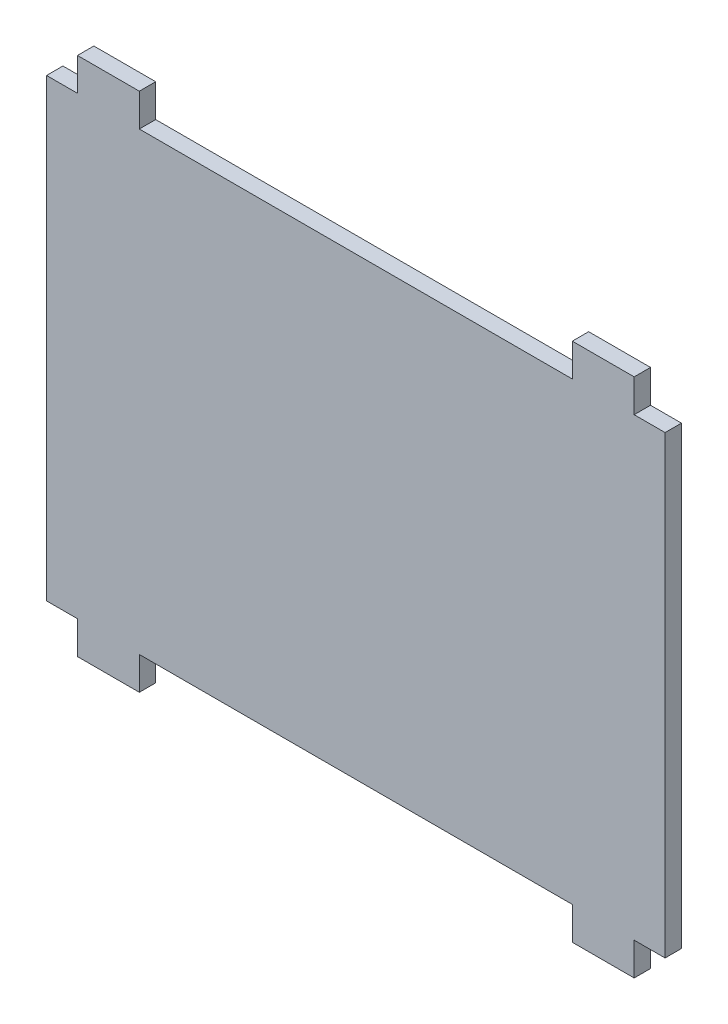
from build123d import *

# Parameters (mm, degrees)
SKETCH1_W           = 60
SKETCH1_H           = 25.25
BOSS_EXTRUDE1_DEPTH = 1.5875
SKETCH2_W           = 42
SKETCH2_H           = 3.18
SKETCH2_W_2         = 5.7
SKETCH2_W_3         = 5.8
CUT_EXTRUDE1_DEPTH  = 1.5875


with BuildPart() as part:
    # Sketch1 → Boss-Extrude1 (new body)
    with BuildSketch(Plane.XY):
        with Locations((0, 12.625)):
            Rectangle(SKETCH1_W, SKETCH1_H)
    boss_extrude1 = extrude(amount=BOSS_EXTRUDE1_DEPTH)

    # Sketch2 → Cut-Extrude1 (cut)
    with BuildSketch(Plane.XY.offset(1.5875)):
        with Locations((0, 23.66)):
            Rectangle(SKETCH2_W, SKETCH2_H)
        with Locations((29.85, 23.66)):
            Rectangle(SKETCH2_W_2, SKETCH2_H)
        with Locations((-29.9, 23.66)):
            Rectangle(SKETCH2_W_3, SKETCH2_H)
    cut_extrude1 = extrude(amount=-CUT_EXTRUDE1_DEPTH, mode=Mode.SUBTRACT)

    # Mirror1: Boss-Extrude1, Cut-Extrude1 across plane
    add(boss_extrude1.mirror(Plane.ZX))
    add(cut_extrude1.mirror(Plane.ZX), mode=Mode.SUBTRACT)


solid = part.part
